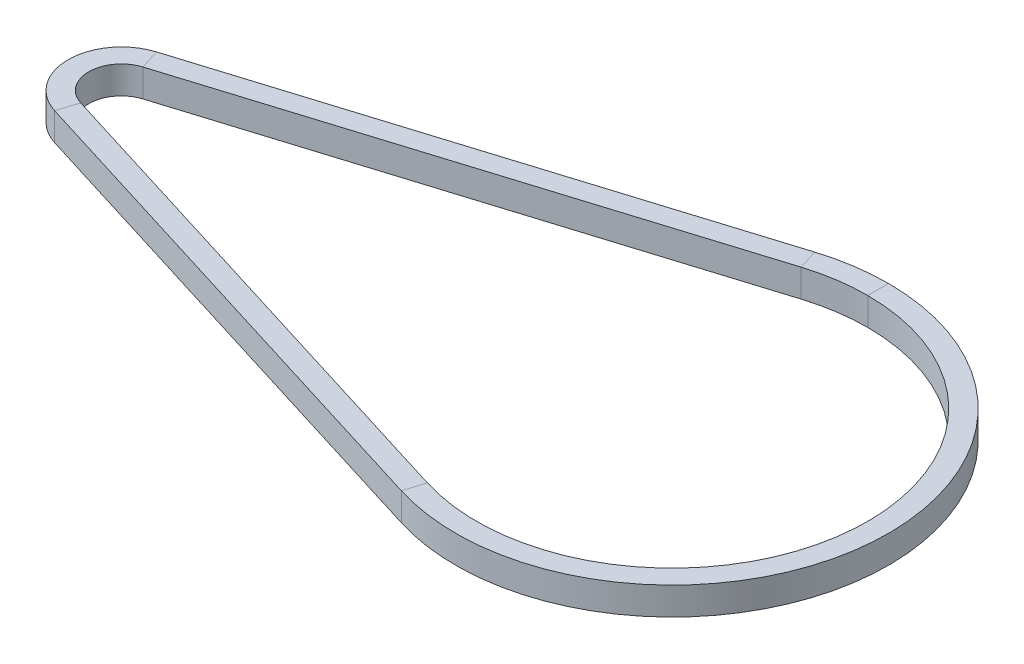
from build123d import *

# Parameters (mm, degrees)
SKETCH2_W = 3
SKETCH2_H = 4


with BuildPart() as part:
    # Sweep1: sweep along a path in Sketch1
    with BuildLine(Plane(origin=(0, 0, 0), x_dir=(1, 0, 0), z_dir=(0, 1, 0))) as sweep1_path:
        Line((-1.391672956, 4.489236726), (71.138118239, 26.973626627))
        ThreePointArc((71.138118239, 26.973626627), (107.74, 0), (71.138118239, -26.973626627))
        Line((71.138118239, -26.973626627), (-1.391672956, -4.489236726))
        ThreePointArc((-1.391672956, -4.489236726), (-4.7, 0), (-1.391672956, 4.489236726))
    # Sketch2 → Sweep1 (sweep)
    with BuildSketch(Plane(origin=(79.5, 0, 0), x_dir=(0, 0, -1), z_dir=(1, 0, 0))):
        with Locations((29.74, 0)):
            Rectangle(SKETCH2_W, SKETCH2_H)
    sweep(path=sweep1_path.line)


solid = part.part
